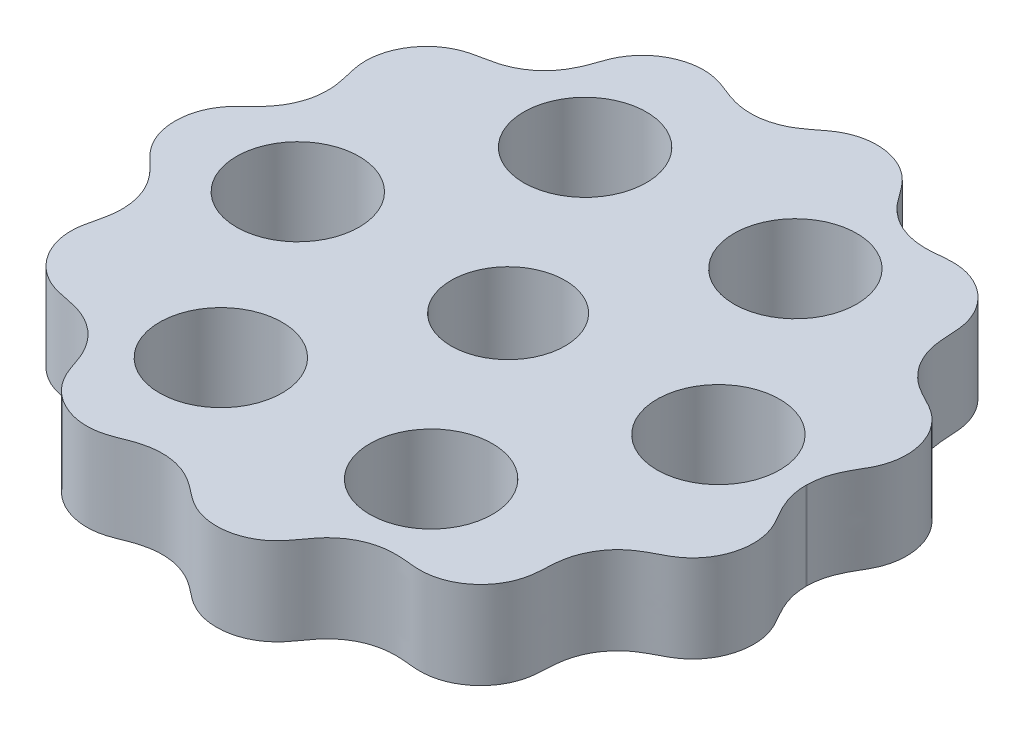
from build123d import *

# Parameters (mm, degrees)
SKETCH3_R           = 3.25
SKETCH3_R_2         = 3.5
BOSS_EXTRUDE1_DEPTH = 5


with BuildPart() as part:
    # Sketch3 → Boss-Extrude1 (new body)
    with BuildSketch(Plane(origin=(0, 0, 0), x_dir=(1, 0, 0), z_dir=(0, 1, 0))):
        with BuildLine():
            ThreePointArc((17.000331205, 0.049384627), (16.999871249, 0.024694288), (17, 0))
            add(Edge.make_bspline(
                [(17, 0), (17, -0.063980976), (17.004599157, -0.204625278), (17.015175753, -0.339072956), (17.034468661, -0.517549728), (17.082710297, -0.798176406), (17.14163717, -1.026170187), (17.249186109, -1.362776959), (17.385070257, -1.677528771), (17.557546583, -2.017529884), (17.709704046, -2.280896601), (17.834511069, -2.497676441), (17.931729359, -2.67355344), (18.037090453, -2.8791866), (18.141932715, -3.116342109), (18.23860986, -3.396773013), (18.309970841, -3.682451052), (18.356079786, -3.974037135), (18.383652231, -4.369662286), (18.353524976, -4.871614667), (18.214067888, -5.463338232), (17.976952899, -6.021715044), (17.704885197, -6.442304513), (17.449302851, -6.743438357), (17.241760191, -6.948129103), (17.013337034, -7.137391458), (16.755047841, -7.3161223), (16.528806718, -7.448115095), (16.260437907, -7.588521865), (15.987122289, -7.730358813), (15.620815447, -7.927464497), (14.961090709, -8.359032423), (14.318137012, -9.113466191), (13.853734336, -10.011019198), (13.702790405, -10.862121935), (13.675724522, -11.293380445), (13.658387328, -11.615491699), (13.646728868, -11.84768127), (13.62814998, -12.084181007), (13.593077603, -12.343921901), (13.527690389, -12.642887265), (13.440735743, -12.921637005), (13.291955629, -13.283293921), (13.042732424, -13.717885018), (12.656336163, -14.182178108), (12.193473804, -14.577498943), (11.67272442, -14.886310846), (11.208367414, -15.062684105), (10.825548494, -15.153035666), (10.534038143, -15.195397243), (10.234060319, -15.212605093), (9.962297796, -15.206357693), (9.703026727, -15.187443196), (9.459214988, -15.163774612), (9.112510905, -15.132980653), (8.606456553, -15.103929783), (7.896804139, -15.17800753), (7.187088173, -15.379384555), (6.515624757, -15.745060466), (5.884176141, -16.269685841), (5.514831132, -16.736772986), (5.309154407, -17.017178436), (5.144167898, -17.249454735), (4.98491294, -17.466342307), (4.8201365, -17.668315025), (4.604766175, -17.893584997), (4.38372904, -18.087754678), (4.148644503, -18.260532581), (3.809419632, -18.46638647), (3.168861392, -18.749593696), (2.355088123, -18.879587943), (1.657317896, -18.810677808), (1.269308281, -18.720806685), (0.990339982, -18.629817651), (0.721547569, -18.51518476), (0.453431586, -18.372060838), (0.233796039, -18.230600661), (0.046840838, -18.09441333), (-0.127037523, -17.959805477), (-0.3665143, -17.772459546), (-0.674012673, -17.536867346), (-1.296828581, -17.132668872), (-2.180213349, -16.841213105), (-2.970693982, -16.765484644), (-3.592629341, -16.833099047), (-4.182834595, -16.975247018), (-4.571968276, -17.123340296), (-4.871974324, -17.241990958), (-5.149219731, -17.352270073), (-5.420922747, -17.446659463), (-5.719126701, -17.525843056), (-6.008988765, -17.576651745), (-6.401102413, -17.610655), (-6.895355056, -17.588335648), (-7.682569484, -17.414180703), (-8.413034882, -17.039090443), (-8.934044945, -16.570409848), (-9.190566677, -16.271181015), (-9.35982283, -16.034215545), (-9.511761819, -15.776829862), (-9.625740251, -15.540326805), (-9.708119461, -15.339602974), (-9.774135927, -15.162384635), (-9.857790309, -14.919561755), (-9.969401131, -14.609557499), (-10.127479978, -14.182903318), (-10.46612936, -13.578690651), (-10.892041261, -13.038698538), (-11.495567901, -12.540602766), (-12.267599223, -12.138885763), (-12.888979023, -11.978508441), (-13.243144044, -11.904698882), (-13.529995454, -11.849556953), (-13.73542707, -11.807381367), (-13.95467702, -11.7554871), (-14.20530845, -11.680414181), (-14.4872286, -11.5699263), (-14.748609067, -11.440228856), (-15.083048113, -11.235784068), (-15.473198266, -10.92092238), (-15.871232461, -10.466198652), (-16.189176564, -9.945859494), (-16.411253395, -9.386161611), (-16.512936186, -8.896182211), (-16.541323163, -8.508479672), (-16.537271257, -8.213833147), (-16.505740678, -7.901778268), (-16.459404271, -7.644588412), (-16.396063416, -7.371554654), (-16.325173266, -7.079596014), (-16.243713059, -6.718907167), (-16.130790021, -6.048559667), (-16.19839901, -5.151376689), (-16.42155025, -4.402516007), (-16.741904091, -3.814245759), (-17.139223568, -3.288063883), (-17.449281337, -2.981085804), (-17.67910912, -2.757264275), (-17.861756426, -2.583076195), (-18.037936396, -2.406492902), (-18.210507552, -2.213787669), (-18.397122447, -1.968255435), (-18.553630301, -1.720067112), (-18.687343677, -1.460271059), (-18.837457833, -1.09217641), (-18.96505093, -0.608231327), (-19.01723043, -0.002150035), (-18.965954327, 0.602643935), (-18.838788147, 1.088290982), (-18.689960312, 1.454382914), (-18.555455457, 1.716829542), (-18.398439638, 1.966541652), (-18.218010374, 2.204662205), (-18.039003031, 2.40488475), (-17.860535535, 2.584786209), (-17.694418957, 2.743510593), (-17.458882784, 2.970266216), (-17.148691381, 3.279040815), (-16.764733943, 3.781417627), (-16.443158558, 4.35226629), (-16.206064607, 5.104982831), (-16.128594199, 6.019490948), (-16.237119961, 6.68907356), (-16.326273943, 7.085284296), (-16.394175465, 7.360517071), (-16.455962974, 7.629671163), (-16.506131162, 7.904850827), (-16.536979669, 8.207181054), (-16.541522189, 8.501787261), (-16.513263984, 8.893955741), (-16.413122679, 9.379622849), (-16.191110015, 9.942234791), (-15.87430905, 10.461870355), (-15.47673116, 10.917576423), (-15.087004092, 11.232944745), (-14.752880703, 11.43786006), (-14.491543127, 11.568010085), (-14.209964651, 11.678819346), (-13.960135327, 11.754004335), (-13.741239144, 11.806066962), (-13.536847738, 11.848234016), (-13.253969075, 11.902650276), (-12.904653773, 11.975053466), (-12.298169442, 12.129182232), (-11.536783868, 12.514438908), (-10.92768577, 13.002191842), (-10.488150854, 13.544867959), (-10.136179285, 14.161690228), (-9.974458862, 14.595948394), (-9.860619855, 14.911040607), (-9.776341269, 15.156283531), (-9.710288372, 15.334103828), (-9.627967463, 15.535338566), (-9.514024479, 15.772568428), (-9.36241011, 16.030241352), (-9.193608517, 16.26729586), (-8.937431476, 16.566983681), (-8.417256478, 17.036256576), (-7.687270389, 17.412410186), (-6.90024635, 17.587685486), (-6.40592829, 17.610714574), (-6.013779704, 17.577277528), (-5.72393363, 17.526894979), (-5.425819981, 17.448171025), (-5.155142204, 17.3544643), (-4.879559422, 17.245065549), (-4.583849569, 17.127975717), (-4.202214266, 16.98203062), (-3.626846218, 16.83970772), (-3.018276913, 16.766835619), (-2.23094569, 16.830614469), (-1.330312933, 17.114551549), (-0.687892199, 17.526413275), (-0.376125678, 17.765023418), (-0.132837866, 17.95517807), (0.041939566, 18.090767404), (0.22910368, 18.227397921), (0.449152164, 18.369525858), (0.717296561, 18.513145418), (0.985765802, 18.628102806), (1.264604646, 18.71948861), (1.652543046, 18.809929594), (2.349985059, 18.879785057), (3.163950773, 18.750987989), (3.805134335, 18.468576075), (4.14455119, 18.263269042), (4.379972192, 18.090764425), (4.601356502, 17.896850957), (4.816645008, 17.672295405), (4.981379007, 17.470844123), (5.140184935, 17.25499892), (5.303161874, 17.025708485), (5.505548935, 16.749131069), (5.864915994, 16.291805546), (6.477421857, 15.772142928), (7.13923761, 15.399135534), (7.854642898, 15.185588927), (8.581265466, 15.103391298), (9.09770355, 15.131863231), (9.450290006, 15.162852345), (9.695875247, 15.186839645), (9.956658075, 15.206081645), (10.229080039, 15.212682228), (10.529150182, 15.195887656), (10.820825104, 15.15392991), (11.203735672, 15.064137429), (11.668280377, 14.888448879), (12.189405056, 14.580405151), (12.652845814, 14.185715675), (13.039898897, 13.721937022), (13.289783336, 13.287657978), (13.439066957, 12.926230432), (13.526482967, 12.647433611), (13.592215459, 12.348870755), (13.62752642, 12.089875802), (13.646286552, 11.853895672), (13.658121981, 11.62329842), (13.674839393, 11.306502951), (13.701613778, 10.881158074), (13.841905899, 10.052941799), (14.289281811, 9.156964689), (14.928679416, 8.385119009), (15.604757987, 7.936108371), (15.975790475, 7.736409498), (16.253609206, 7.591945285), (16.523849353, 7.450923383), (16.750359146, 7.319069374), (17.009540293, 7.140262502), (17.238230911, 6.951319854), (17.445944677, 6.747056344), (17.70203393, 6.446190782), (17.974604868, 6.026139148), (18.212520738, 5.468053329), (18.352795854, 4.876543927), (18.383636405, 4.374590461), (18.356624519, 3.978849962), (18.310925638, 3.687174149), (18.240012485, 3.40148454), (18.143623371, 3.12068777), (18.039574764, 2.884384249), (17.934269227, 2.678381878), (17.838461613, 2.504437175), (17.713828446, 2.288591447), (17.565061974, 2.029284832), (17.394505828, 1.700078364), (17.233249316, 1.318076267), (17.097727539, 0.915771834), (17.022890025, 0.430331868), (17.007772004, 0.252399556), (17.001183045, 0.112890291), (17.000331205, 0.049384627)],
                knots=[0.075229165, 0.075229165, 0.075229165, 0.075229165, 0.075436575, 0.075643985, 0.075851395, 0.076058805, 0.076473626, 0.076888446, 0.077718087, 0.078547728, 0.08020701, 0.081866292, 0.083525573, 0.085184855, 0.088503419, 0.091821982, 0.095140546, 0.098459109, 0.101777673, 0.1084148, 0.115051927, 0.121689054, 0.128326181, 0.131644745, 0.134963308, 0.138281872, 0.141600435, 0.144918999, 0.146578281, 0.148237563, 0.149896844, 0.151556126, 0.152385767, 0.153215408, 0.15487469, 0.156533971, 0.158193253, 0.159852535, 0.161511817, 0.16483038, 0.168148944, 0.171467507, 0.174786071, 0.181423198, 0.188060325, 0.194697452, 0.201334579, 0.207971706, 0.21129027, 0.214608833, 0.217927397, 0.221245961, 0.222905242, 0.224564524, 0.226223806, 0.227883088, 0.228712729, 0.229542369, 0.23037201, 0.231201651, 0.232860933, 0.234520215, 0.236179497, 0.237838778, 0.241157342, 0.244475905, 0.247794469, 0.251113032, 0.254431596, 0.261068723, 0.274342977, 0.280980104, 0.284298668, 0.287617231, 0.290935795, 0.294254359, 0.297572922, 0.299232204, 0.300891486, 0.302550767, 0.304210049, 0.305869331, 0.306698972, 0.307528613, 0.308358254, 0.309187895, 0.310847176, 0.312506458, 0.31416574, 0.317484303, 0.320802867, 0.32412143, 0.327439994, 0.334077121, 0.340714248, 0.353988502, 0.360625629, 0.363944193, 0.367262757, 0.37058132, 0.373899884, 0.375559165, 0.377218447, 0.378877729, 0.380537011, 0.382196293, 0.383025933, 0.383855574, 0.384685215, 0.385514856, 0.387174138, 0.38883342, 0.390492701, 0.392151983, 0.393811265, 0.397129828, 0.400448392, 0.403766956, 0.407085519, 0.413722646, 0.420359773, 0.4269969, 0.433634027, 0.440271155, 0.443589718, 0.446908282, 0.450226845, 0.453545409, 0.455204691, 0.456863972, 0.458523254, 0.460182536, 0.461012177, 0.461841818, 0.462671458, 0.463501099, 0.465160381, 0.466819663, 0.468478945, 0.470138226, 0.47345679, 0.476775354, 0.480093917, 0.483412481, 0.486731044, 0.493368171, 0.500005298, 0.506642425, 0.513279553, 0.516598116, 0.51991668, 0.523235243, 0.526553807, 0.52987237, 0.531531652, 0.533190934, 0.534850216, 0.536509497, 0.537339138, 0.538168779, 0.53899842, 0.539828061, 0.541487343, 0.543146624, 0.544805906, 0.546465188, 0.549783752, 0.553102315, 0.556420879, 0.559739442, 0.566376569, 0.573013696, 0.579650823, 0.586287951, 0.592925078, 0.596243641, 0.599562205, 0.602880768, 0.606199332, 0.607858614, 0.609517895, 0.611177177, 0.612836459, 0.614495741, 0.615325382, 0.616155022, 0.616984663, 0.617814304, 0.619473586, 0.621132868, 0.62279215, 0.624451431, 0.626110713, 0.629429277, 0.63274784, 0.636066404, 0.639384967, 0.646022094, 0.659296349, 0.665933476, 0.672570603, 0.675889166, 0.67920773, 0.682526293, 0.685844857, 0.687504139, 0.68916342, 0.690822702, 0.691652343, 0.692481984, 0.693311625, 0.694141266, 0.695800548, 0.697459829, 0.699119111, 0.700778393, 0.702437675, 0.705756238, 0.709074802, 0.712393365, 0.715711929, 0.719030492, 0.725667619, 0.738941874, 0.745579001, 0.748897564, 0.752216128, 0.755534691, 0.758853255, 0.762171818, 0.7638311, 0.765490382, 0.767149664, 0.768808946, 0.769638586, 0.770468227, 0.771297868, 0.772127509, 0.773786791, 0.775446073, 0.777105354, 0.778764636, 0.7820832, 0.785401763, 0.788720327, 0.79203889, 0.798676017, 0.805313145, 0.811950272, 0.818587399, 0.825224526, 0.828543089, 0.831861653, 0.835180216, 0.83849878, 0.840158062, 0.841817344, 0.843476625, 0.845135907, 0.846795189, 0.84762483, 0.848454471, 0.850113752, 0.851773034, 0.853432316, 0.855091598, 0.858410161, 0.861728725, 0.865047288, 0.868365852, 0.871684415, 0.878321543, 0.88495867, 0.891595797, 0.898232924, 0.901551487, 0.904870051, 0.908188614, 0.911507178, 0.914825742, 0.916485023, 0.918144305, 0.919803587, 0.921462869, 0.92229251, 0.92312215, 0.923951791, 0.924366612, 0.924574022, 0.924781432, 0.924781432, 0.924781432, 0.924781432], degree=3))
        make_face()
        with Locations(Location((0, 0, 0), (0, 0, 270))):
            Circle(SKETCH3_R, mode=Mode.SUBTRACT)
        with Locations(Location((12, 0, 0), (0, 0, 270))):
            Circle(SKETCH3_R_2, mode=Mode.SUBTRACT)
        with Locations(Location((6, -10.392304845, 0), (0, 0, 270))):
            Circle(SKETCH3_R_2, mode=Mode.SUBTRACT)
        with Locations(Location((-6, -10.392304845, 0), (0, 0, 270))):
            Circle(SKETCH3_R_2, mode=Mode.SUBTRACT)
        with Locations(Location((-12, 0, 0), (0, 0, 270))):
            Circle(SKETCH3_R_2, mode=Mode.SUBTRACT)
        with Locations(Location((-6, 10.392304845, 0), (0, 0, 270))):
            Circle(SKETCH3_R_2, mode=Mode.SUBTRACT)
        with Locations(Location((6, 10.392304845, 0), (0, 0, 270))):
            Circle(SKETCH3_R_2, mode=Mode.SUBTRACT)
    extrude(amount=BOSS_EXTRUDE1_DEPTH)


solid = part.part
